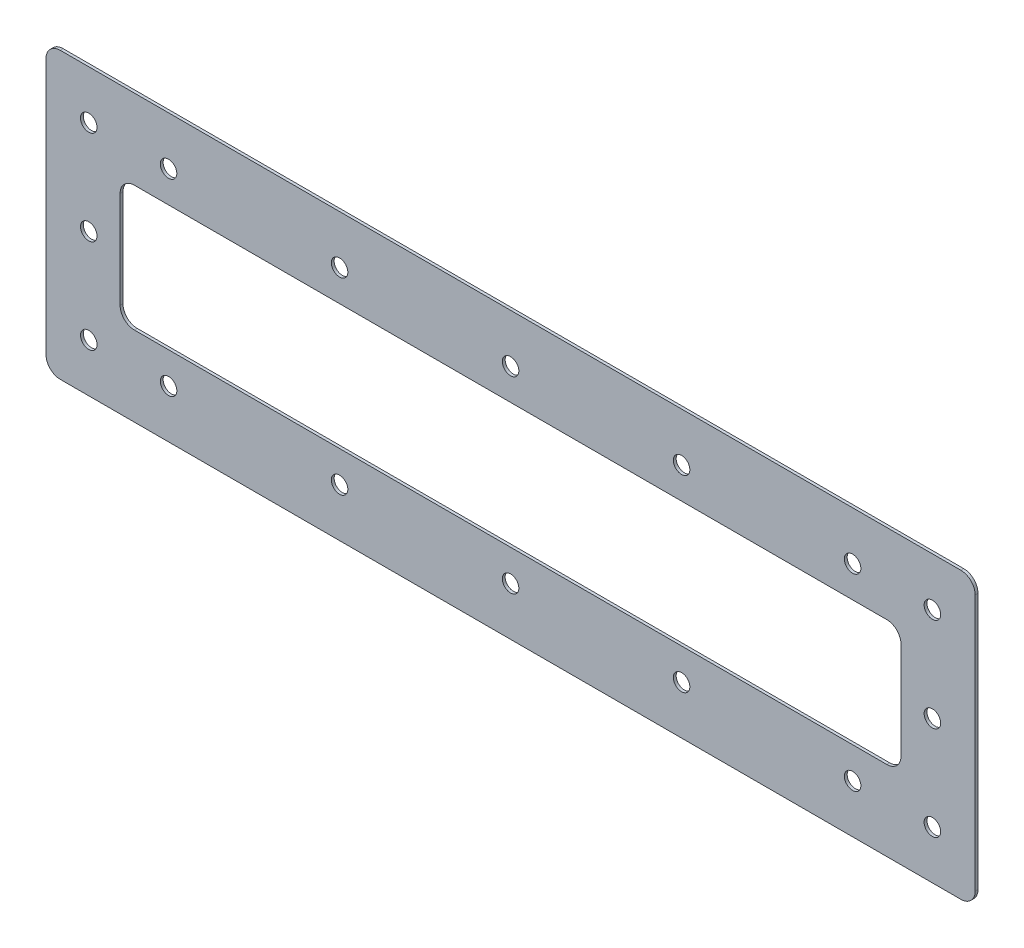
from build123d import *

# Parameters (mm, degrees)
SKETCH1_W            = 326
SKETCH1_H            = 100
SKETCH1_W_2          = 274
SKETCH1_H_2          = 44
BOSS_EXTRUDE1_DEPTH  = 1
FILLET1_R            = 5
M5_CLEARANCE_HOLE1_D = 5.8


with BuildPart() as part:
    # Sketch1 → Boss-Extrude1 (new body)
    with BuildSketch(Plane.XY):
        Rectangle(SKETCH1_W, SKETCH1_H)
        Rectangle(SKETCH1_W_2, SKETCH1_H_2, mode=Mode.SUBTRACT)
    extrude(amount=BOSS_EXTRUDE1_DEPTH)

    # Fillet1
    fillet1_edges = [part.edges().sort_by_distance(p)[0] for p in [
        (-137, 22, 0.5),
        (-137, -22, 0.5),
        (137, -22, 0.5),
        (137, 22, 0.5),
        (163, -50, 0.5),
        (-163, -50, 0.5),
        (-163, 50, 0.5),
        (163, 50, 0.5),
    ]]
    fillet(fillet1_edges, radius=FILLET1_R)

    # M5 Clearance Hole1 (through all)
    with Locations(Plane(origin=(0, 0, 0), x_dir=(-1, 0, 0), z_dir=(0, 0, -1))):
        with Locations((0, 33), (60, 33), (120, 33), (148, 33), (148, 0), (148, -33), (120, -33), (60, -33), (0, -33), (-60, 33), (-60, -33), (-120, -33), (-148, -33), (-148, 0), (-148, 33), (-120, 33)):
            Hole(M5_CLEARANCE_HOLE1_D / 2)


solid = part.part
